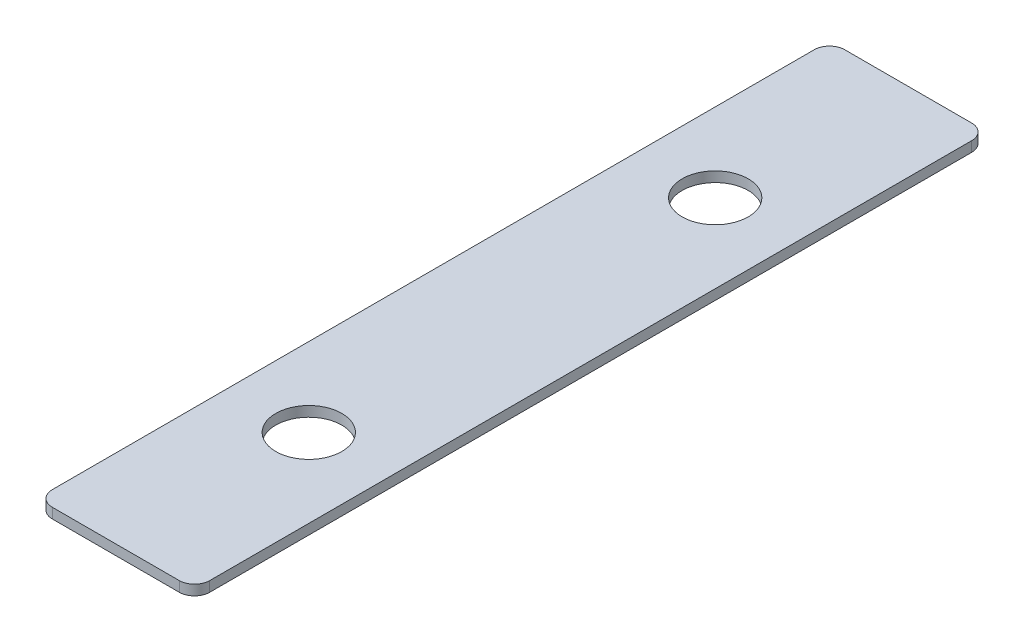
from build123d import *

# Parameters (mm, degrees)
SKETCH1_R           = 6.5
BOSS_EXTRUDE1_DEPTH = 2


with BuildPart() as part:
    # Sketch1 → Boss-Extrude1 (new body)
    with BuildSketch(Plane(origin=(0, 0, 0), x_dir=(1, 0, 0), z_dir=(0, 1, 0))):
        with BuildLine():
            Line((-16, -75.5), (-16, 74.5))
            ThreePointArc((-16, 74.5), (-15.121320344, 76.621320344), (-13, 77.5))
            Line((-13, 77.5), (12, 77.5))
            ThreePointArc((12, 77.5), (14.121320344, 76.621320344), (15, 74.5))
            Line((15, 74.5), (15, -75.5))
            ThreePointArc((15, -75.5), (14.121320344, -77.621320344), (12, -78.5))
            Line((12, -78.5), (-13, -78.5))
            ThreePointArc((-13, -78.5), (-15.121320344, -77.621320344), (-16, -75.5))
        make_face()
        with Locations(Location((-0.5, 39.5, 0), (0, 0, 270))):
            Circle(SKETCH1_R, mode=Mode.SUBTRACT)
        with Locations(Location((-0.5, -40.5, 0), (0, 0, 270))):
            Circle(SKETCH1_R, mode=Mode.SUBTRACT)
    extrude(amount=BOSS_EXTRUDE1_DEPTH)


solid = part.part
